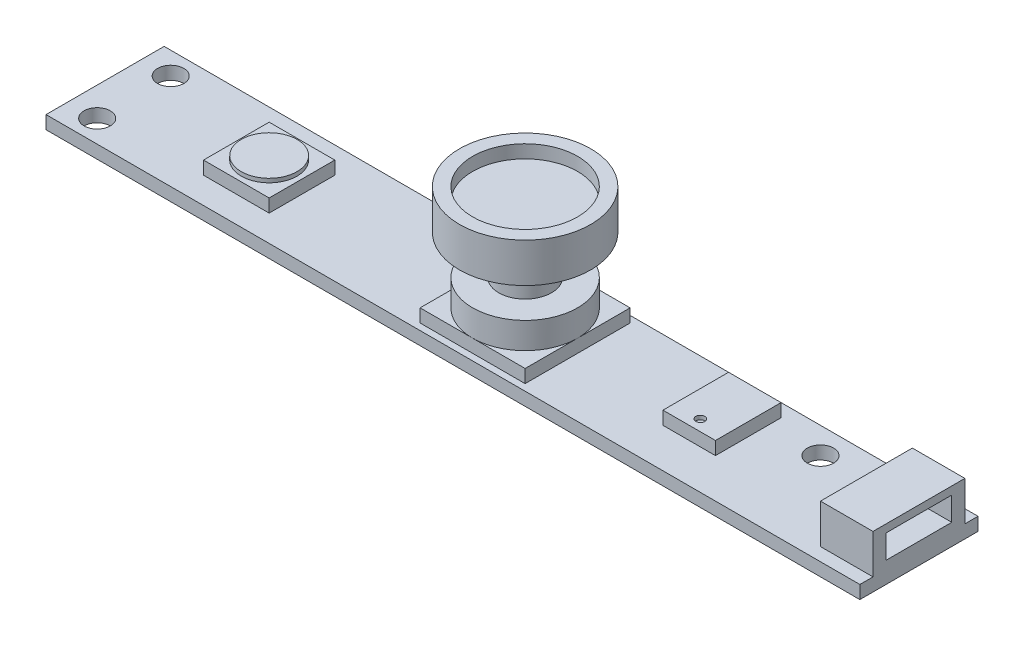
from build123d import *

# Parameters (mm, degrees)
SKETCH1_W            = 62
SKETCH1_H            = 9
BOSS_EXTRUDE1_DEPTH  = 1
BOSS_EXTRUDE2_DEPTH  = 3
SKETCH3_W            = 5
SKETCH3_H            = 1.8
CUT_EXTRUDE1_DEPTH   = 3
SKETCH4_R            = 1
CUT_EXTRUDE2_DEPTH   = 63.721607122
SKETCH5_W            = 4
SKETCH5_H            = 5
BOSS_EXTRUDE4_DEPTH  = 1
BOSS_EXTRUDE5_DEPTH  = 1
SKETCH7_R            = 2.125973312
BOSS_EXTRUDE6_DEPTH  = 0.3
BOSS_EXTRUDE7_DEPTH  = 1
SKETCH9_R            = 4
BOSS_EXTRUDE8_DEPTH  = 2
SKETCH10_R           = 2.014523047
BOSS_EXTRUDE9_DEPTH  = 3
SKETCH11_R           = 5
BOSS_EXTRUDE10_DEPTH = 3
CUT_EXTRUDE3_START   = -1
SKETCH12_R           = 4
CUT_EXTRUDE3_DEPTH   = 1
SKETCH13_R           = 0.341110464
CUT_EXTRUDE4_DEPTH   = 0.3


with BuildPart() as part:
    # Sketch1 → Boss-Extrude1 (new body)
    with BuildSketch(Plane(origin=(0, 0, 0), x_dir=(1, 0, 0), z_dir=(0, 1, 0))):
        with Locations((31, 4.5)):
            Rectangle(SKETCH1_W, SKETCH1_H)
    extrude(amount=BOSS_EXTRUDE1_DEPTH)

    # Sketch2 → Boss-Extrude2 (add)
    with BuildSketch(Plane(origin=(0, 1, 0), x_dir=(1, 0, 0), z_dir=(0, 1, 0))):
        Polygon((62, 4.5), (62, 8), (58, 8), (58, 1), (62, 1), align=None)
    extrude(amount=BOSS_EXTRUDE2_DEPTH)

    # Sketch3 → Cut-Extrude1 (cut)
    with BuildSketch(Plane(origin=(62, 0, 0), x_dir=(0, 0, -1), z_dir=(1, 0, 0))):
        with Locations((4.5, 2.5)):
            Rectangle(SKETCH3_W, SKETCH3_H)
    extrude(amount=-CUT_EXTRUDE1_DEPTH, mode=Mode.SUBTRACT)

    # Sketch4 → Cut-Extrude2 (cut, through all)
    with BuildSketch(Plane(origin=(0, 1, 0), x_dir=(1, 0, 0), z_dir=(0, 1, 0))):
        with Locations(Location((2.2, 7.3, 0), (0, 0, 270))):
            Circle(SKETCH4_R)
        with Locations(Location((2.2, 1.7, 0), (0, 0, 270))):
            Circle(SKETCH4_R)
        with Locations(Location((52, 7, 0), (0, 0, 270))):
            Circle(SKETCH4_R)
    extrude(amount=-CUT_EXTRUDE2_DEPTH, mode=Mode.SUBTRACT)

    # Sketch5 → Boss-Extrude4 (add)
    with BuildSketch(Plane(origin=(0, 1, 0), x_dir=(1, 0, 0), z_dir=(0, 1, 0))):
        with Locations((46, 5.5)):
            Rectangle(SKETCH5_W, SKETCH5_H)
    extrude(amount=BOSS_EXTRUDE4_DEPTH)

    # Sketch6 → Boss-Extrude5 (add)
    with BuildSketch(Plane(origin=(0, 1, 0), x_dir=(1, 0, 0), z_dir=(0, 1, 0))):
        Polygon((10, 2), (10, 4.5), (10, 7), (15, 7), (15, 4.5), (15, 2), align=None)
    extrude(amount=BOSS_EXTRUDE5_DEPTH)

    # Sketch7 → Boss-Extrude6 (add)
    with BuildSketch(Plane(origin=(0, 2, 0), x_dir=(1, 0, 0), z_dir=(0, 1, 0))):
        with Locations(Location((12.5, 4.5, 0), (0, 0, 270))):
            Circle(SKETCH7_R)
    extrude(amount=BOSS_EXTRUDE6_DEPTH)

    # Sketch8 → Boss-Extrude7 (add)
    with BuildSketch(Plane(origin=(0, 1, 0), x_dir=(1, 0, 0), z_dir=(0, 1, 0))):
        Polygon((36, 8.5), (28, 8.5), (28, 4.5), (28, 0.5), (36, 0.5), (36, 4.5), align=None)
    extrude(amount=BOSS_EXTRUDE7_DEPTH)

    # Sketch9 → Boss-Extrude8 (add)
    with BuildSketch(Plane(origin=(0, 2, 0), x_dir=(1, 0, 0), z_dir=(0, 1, 0))):
        with Locations(Location((32, 4.5, 0), (0, 0, 270))):
            Circle(SKETCH9_R)
    extrude(amount=BOSS_EXTRUDE8_DEPTH)

    # Sketch10 → Boss-Extrude9 (add)
    with BuildSketch(Plane(origin=(0, 4, 0), x_dir=(1, 0, 0), z_dir=(0, 1, 0))):
        with Locations(Location((32, 4.5, 0), (0, 0, 270))):
            Circle(SKETCH10_R)
    extrude(amount=BOSS_EXTRUDE9_DEPTH)

    # Sketch11 → Boss-Extrude10 (add)
    with BuildSketch(Plane(origin=(0, 7, 0), x_dir=(1, 0, 0), z_dir=(0, 1, 0))):
        with Locations(Location((32, 4.5, 0), (0, 0, 270))):
            Circle(SKETCH11_R)
    extrude(amount=BOSS_EXTRUDE10_DEPTH)

    # Sketch12 → Cut-Extrude3 (cut)
    with BuildSketch(Plane(origin=(0, 10, 0), x_dir=(1, 0, 0), z_dir=(0, 1, 0)).offset(CUT_EXTRUDE3_START)):
        with Locations(Location((32, 4.5, 0), (0, 0, 270))):
            Circle(SKETCH12_R)
    extrude(amount=CUT_EXTRUDE3_DEPTH, mode=Mode.SUBTRACT)

    # Sketch13 → Cut-Extrude4 (cut)
    with BuildSketch(Plane(origin=(0, 2, 0), x_dir=(1, 0, 0), z_dir=(0, 1, 0))):
        with Locations(Location((46, 3.845478616, 0), (0, 0, 270))):
            Circle(SKETCH13_R)
    extrude(amount=-CUT_EXTRUDE4_DEPTH, mode=Mode.SUBTRACT)


solid = part.part
